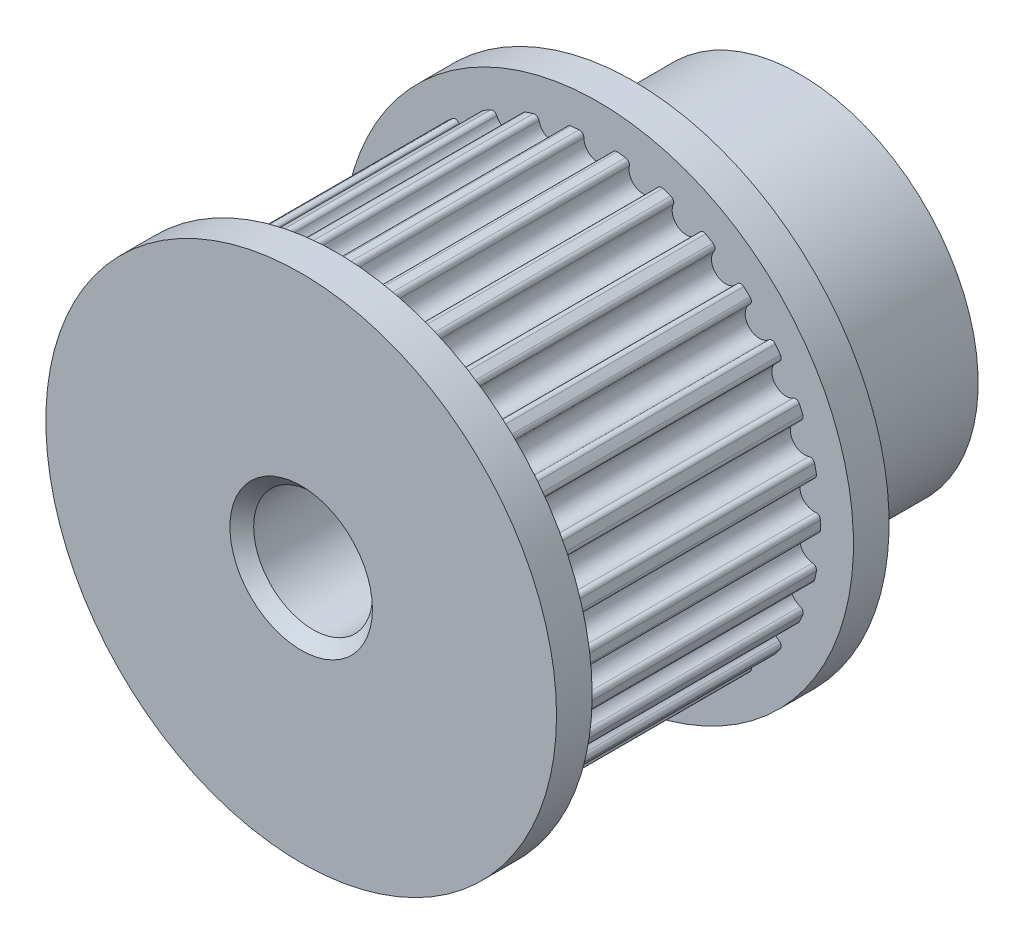
from build123d import *

# Parameters (mm, degrees)
SKETCHREVOLVEGEARBELT01_W       = 11
SKETCHREVOLVEGEARBELT01_H       = 9.358796445
TOOTHEXTRUDECUTGEARBELT01_DEPTH = 5.6
PATTERNGEARBELT01_COUNT         = 30
SKETCH5_R                       = 10.75
BOSS_EXTRUDE1_DEPTH             = 1.5
BOSS_EXTRUDE2_START             = 1.5
SKETCH6_R                       = 10.75
BOSS_EXTRUDE2_DEPTH             = 1.5
SKETCH7_R                       = 7.5
BOSS_EXTRUDE3_DEPTH             = 7
SKETCH8_R                       = 2.5
CUT_EXTRUDE2_DEPTH              = 26.925373671
CHAMFER1_SIZE                   = 0.5


with BuildPart() as part:
    # SketchRevolveGearBelt01 → GearBelt01 (revolve)
    with BuildSketch(Plane(origin=(0, 0, 0), x_dir=(0, 0, -1), z_dir=(1, 0, 0))):
        with Locations((0, 4.679398223)):
            Rectangle(SKETCHREVOLVEGEARBELT01_W, SKETCHREVOLVEGEARBELT01_H)
    revolve(axis=Axis((0, 0, 0), (0, 0, -1)))

    # SketchToothGearBelt01 → ToothExtrudeCutGearBelt01 (cut, symmetric)
    with BuildSketch(Plane.XY):
        with BuildLine():
            Line((-0.801188335, 9.324439294), (0, 11.898796407))
            Line((0, 11.898796407), (0.801188335, 9.324439294))
            ThreePointArc((0.801188335, 9.324439294), (0.660014555, 9.276333742), (0.599999991, 9.139796448))
            ThreePointArc((0.599999991, 9.139796448), (0, 8.539796457), (-0.599999991, 9.139796448))
            ThreePointArc((-0.599999991, 9.139796448), (-0.660014555, 9.276333742), (-0.801188335, 9.324439294))
        make_face()
    toothextrudecutgearbelt01 = extrude(amount=TOOTHEXTRUDECUTGEARBELT01_DEPTH, both=True, mode=Mode.SUBTRACT)

    # PatternGearBelt01: ToothExtrudeCutGearBelt01 ×30 about axis
    patterngearbelt01_axis = Axis((0, 0, 55), (0, 0, -1))
    for i in range(1, PATTERNGEARBELT01_COUNT):
        add(toothextrudecutgearbelt01.rotate(patterngearbelt01_axis, i * 360 / PATTERNGEARBELT01_COUNT), mode=Mode.SUBTRACT)

    # Sketch5 → Boss-Extrude1 (add)
    with BuildSketch(Plane.XY.offset(5.5)):
        Circle(SKETCH5_R)
    extrude(amount=BOSS_EXTRUDE1_DEPTH)

    # Sketch6 → Boss-Extrude2 (add)
    with BuildSketch(Plane(origin=(0, 0, -5.5), x_dir=(-1, 0, 0), z_dir=(0, 0, -1)).offset(BOSS_EXTRUDE2_START)):
        Circle(SKETCH6_R)
    extrude(amount=-BOSS_EXTRUDE2_DEPTH)

    # Sketch7 → Boss-Extrude3 (add)
    with BuildSketch(Plane(origin=(0, 0, -7), x_dir=(-1, 0, 0), z_dir=(0, 0, -1))):
        Circle(SKETCH7_R)
    extrude(amount=BOSS_EXTRUDE3_DEPTH)

    # Sketch8 → Cut-Extrude2 (cut, through all)
    with BuildSketch(Plane(origin=(0, 0, -14), x_dir=(-1, 0, 0), z_dir=(0, 0, -1))):
        Circle(SKETCH8_R)
    extrude(amount=-CUT_EXTRUDE2_DEPTH, mode=Mode.SUBTRACT)

    # Chamfer1
    chamfer1_edges = [part.edges().sort_by_distance(p)[0] for p in [
        (2.5, 0, -14),
        (2.5, 0, 7),
    ]]
    chamfer(chamfer1_edges, length=CHAMFER1_SIZE)


solid = part.part
